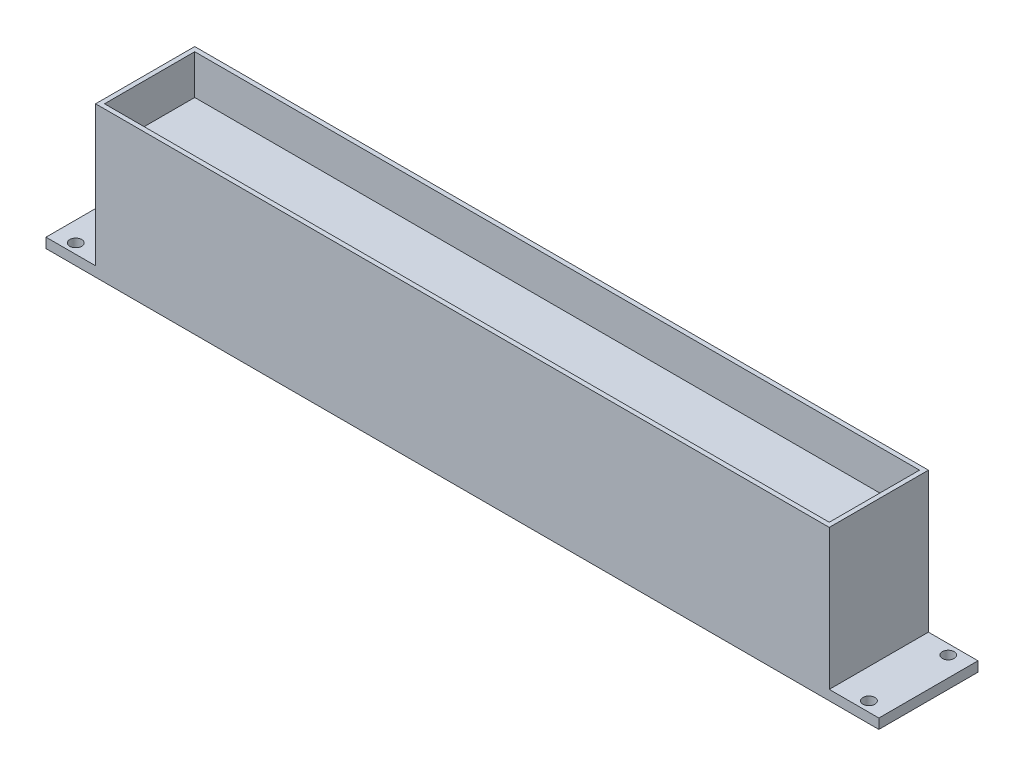
from build123d import *

# Parameters (mm, degrees)
SKETCH1_W           = 420
SKETCH1_H           = 50
SKETCH1_R           = 3
BOSS_EXTRUDE1_DEPTH = 75.75
SKETCH2_W           = 365.5
SKETCH2_H           = 45.5
CUT_EXTRUDE1_DEPTH  = 20
SKETCH3_W           = 25
SKETCH3_H           = 50
CUT_EXTRUDE2_DEPTH  = 70.75


with BuildPart() as part:
    # Sketch1 → Boss-Extrude1 (new body)
    with BuildSketch(Plane(origin=(0, 0, 0), x_dir=(1, 0, 0), z_dir=(0, 1, 0))):
        Rectangle(SKETCH1_W, SKETCH1_H)
        with Locations(Location((-200, -20, 0), (0, 0, 270))):
            Circle(SKETCH1_R, mode=Mode.SUBTRACT)
        with Locations(Location((200, -20, 0), (0, 0, 270))):
            Circle(SKETCH1_R, mode=Mode.SUBTRACT)
        with Locations(Location((-200, 20, 0), (0, 0, 270))):
            Circle(SKETCH1_R, mode=Mode.SUBTRACT)
        with Locations(Location((200, 20, 0), (0, 0, 90))):
            Circle(SKETCH1_R, mode=Mode.SUBTRACT)
    extrude(amount=BOSS_EXTRUDE1_DEPTH)

    # Sketch2 → Cut-Extrude1 (cut)
    with BuildSketch(Plane(origin=(0, 75.75, 0), x_dir=(1, 0, 0), z_dir=(0, 1, 0))):
        Rectangle(SKETCH2_W, SKETCH2_H)
    extrude(amount=-CUT_EXTRUDE1_DEPTH, mode=Mode.SUBTRACT)

    # Sketch3 → Cut-Extrude2 (cut)
    with BuildSketch(Plane(origin=(0, 75.75, 0), x_dir=(1, 0, 0), z_dir=(0, 1, 0))):
        with Locations((-197.5, 0)):
            Rectangle(SKETCH3_W, SKETCH3_H)
    cut_extrude2 = extrude(amount=-CUT_EXTRUDE2_DEPTH, mode=Mode.SUBTRACT)

    # Mirror1: Cut-Extrude2 across plane
    add(cut_extrude2.mirror(Plane(origin=(0, 0, 0), x_dir=(0, 0, 1), z_dir=(1, 0, 0))), mode=Mode.SUBTRACT)


solid = part.part
